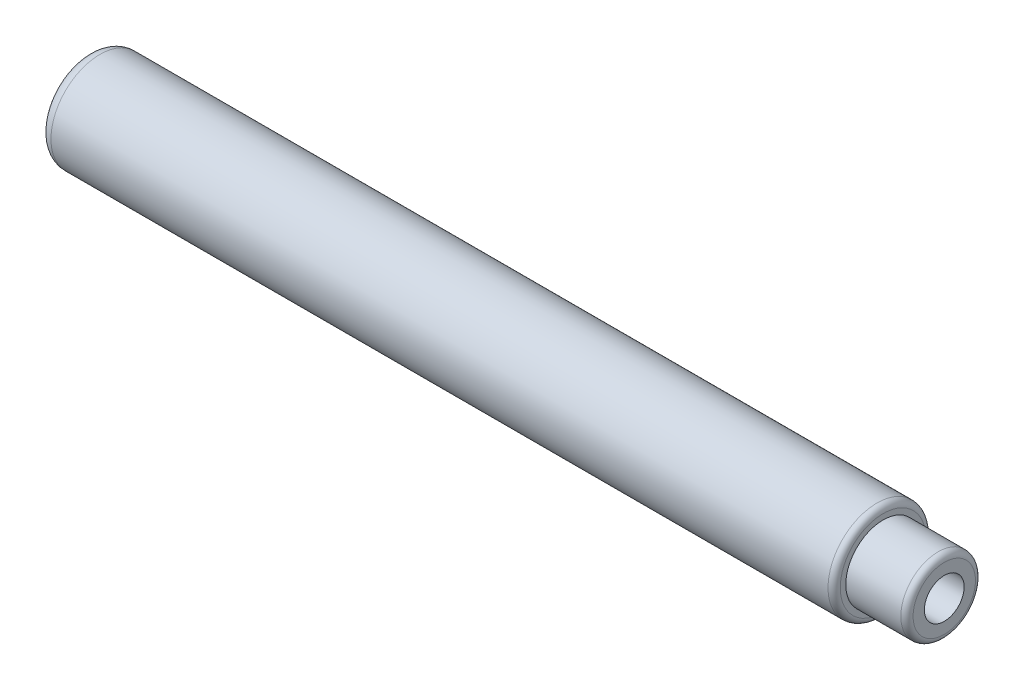
from build123d import *

# Parameters (mm, degrees)
IZIM1_W               = 140
IZIM1_H               = 8
KES_EKSTR_ZYON1_START = -10
IZIM2_R               = 8
IZIM2_R_2             = 6.1
KES_EKSTR_ZYON1_DEPTH = 10
IZIM3_R               = 3.25
KES_EKSTR_ZYON2_DEPTH = 10
RADYUS1_R             = 2
RADYUS2_R             = 1


with BuildPart() as part:
    # Çizim1 → Döndür1 (revolve)
    with BuildSketch(Plane.XY, mode=Mode.PRIVATE) as d_nd_r1_sk:
        with Locations((70, 4)):
            Rectangle(IZIM1_W, IZIM1_H)
    revolve(d_nd_r1_sk.sketch.rotate(Axis((0, 0, 0), (1, 0, 0)), 90), axis=Axis((0, 0, 0), (1, 0, 0)))

    # Çizim2 → Kes-Ekstrüzyon1 (cut)
    with BuildSketch(Plane(origin=(140, 0, 0), x_dir=(0, 0, -1), z_dir=(1, 0, 0)).offset(KES_EKSTR_ZYON1_START)):
        with Locations(Location((0, 0, 0), (0, 0, 180))):
            Circle(IZIM2_R)
        Circle(IZIM2_R_2, mode=Mode.SUBTRACT)
    extrude(amount=KES_EKSTR_ZYON1_DEPTH, mode=Mode.SUBTRACT)

    # Çizim3 → Kes-Ekstrüzyon2 (cut)
    with BuildSketch(Plane(origin=(140, 0, 0), x_dir=(0, 0, -1), z_dir=(1, 0, 0))):
        Circle(IZIM3_R)
    extrude(amount=-KES_EKSTR_ZYON2_DEPTH, mode=Mode.SUBTRACT)

    # Radyus1
    radyus1_edges = [part.edges().sort_by_distance(p)[0] for p in [
        (0, 0, -8),
    ]]
    fillet(radyus1_edges, radius=RADYUS1_R)

    # Radyus2
    radyus2_edges = [part.edges().sort_by_distance(p)[0] for p in [
        (130, 0, -8),
        (140, 0, 6.1),
    ]]
    fillet(radyus2_edges, radius=RADYUS2_R)


solid = part.part
